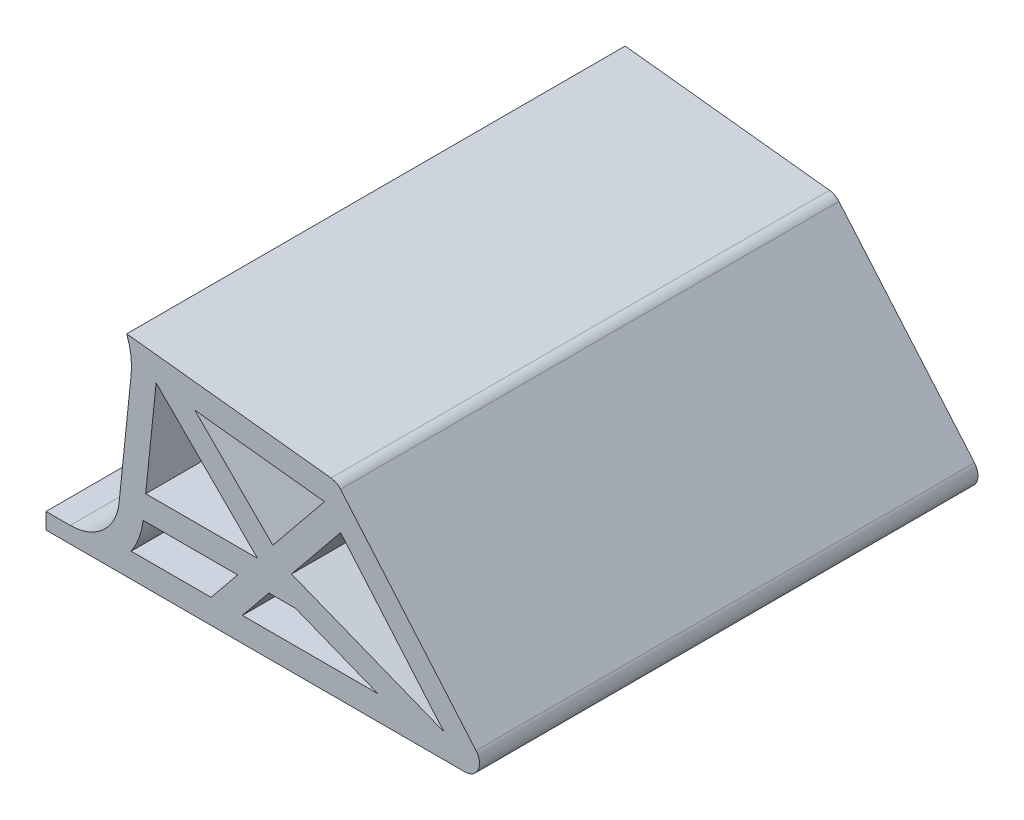
from build123d import *

# Parameters (mm, degrees)
BOSS_EXTRUDE1_DEPTH = 51.31
CUT_EXTRUDE1_DEPTH  = 169.903952009
EXTRUDE_THIN1_START = -51.31
EXTRUDE_THIN1_DEPTH = 102.62


with BuildPart() as part:
    # Sketch1 → Boss-Extrude1 (new, symmetric)
    with BuildSketch(Plane.XY):
        with BuildLine():
            Line((59.876515773, 19.086695264), (57.402885491, -4.903230804))
            ThreePointArc((57.402885491, -4.903230804), (54.121767552, -11.36639665), (47.356152322, -13.9673))
            Line((47.356152322, -13.9673), (42.356152322, -13.9673))
            Line((42.356152322, -13.9673), (42.356152322, -17.293867679))
            Line((42.356152322, -17.293867679), (128.611229128, -17.293867679))
            ThreePointArc((128.611229128, -17.293867679), (131.335936638, -15.549243714), (130.891584134, -12.344513672))
            Line((130.891584134, -12.344513672), (102.990355006, 20.294354008))
            ThreePointArc((102.990355006, 20.294354008), (102.114192176, 20.996083615), (101.041429063, 21.326636258))
            Line((101.041429063, 21.326636258), (58.969893766, 26.003172338))
            ThreePointArc((58.969893766, 26.003172338), (59.828073734, 22.598004621), (59.876515773, 19.086695264))
        make_face()
    extrude(amount=BOSS_EXTRUDE1_DEPTH, both=True)

    # Sketch2 → Cut-Extrude1 (cut, through all)
    with BuildSketch(Plane.XY.offset(51.31)):
        with BuildLine():
            Line((65.02802496, 20.298975288), (62.376515773, -5.416067836))
            ThreePointArc((62.376515773, -5.416067836), (61.55413792, -9.00803973), (59.886234411, -12.293867679))
            Line((59.886234411, -12.293867679), (124.270366416, -12.293867679))
            Line((124.270366416, -12.293867679), (99.70340547, 16.444571904))
            Line((99.70340547, 16.444571904), (65.02802496, 20.298975288))
        make_face()
    extrude(amount=-CUT_EXTRUDE1_DEPTH, mode=Mode.SUBTRACT)

    # Sketch3 → Extrude-Thin1 (add)
    with BuildSketch(Plane.XY.offset(EXTRUDE_THIN1_START)):
        Polygon((99.70340547, 16.444571904), (76.337464228, -12.293867679), (80.216979633, -15.448128325), (103.582920875, 13.290311258), align=None)
        Polygon((124.270366416, -12.293867679), (88.020434849, 2.075352112), (86.177943711, -2.572790141), (122.427875278, -16.942009933), align=None)
        Polygon((65.02802496, 20.298975288), (85.881897007, -0.554896759), (62.877757, -0.554896759), (59.886234411, -0.554896759), (59.886234411, -5.554896759), (62.877757, -5.554896759), (97.952964819, -5.554896759), (68.563558866, 23.834509194), align=None)
    extrude(amount=EXTRUDE_THIN1_DEPTH)


solid = part.part
